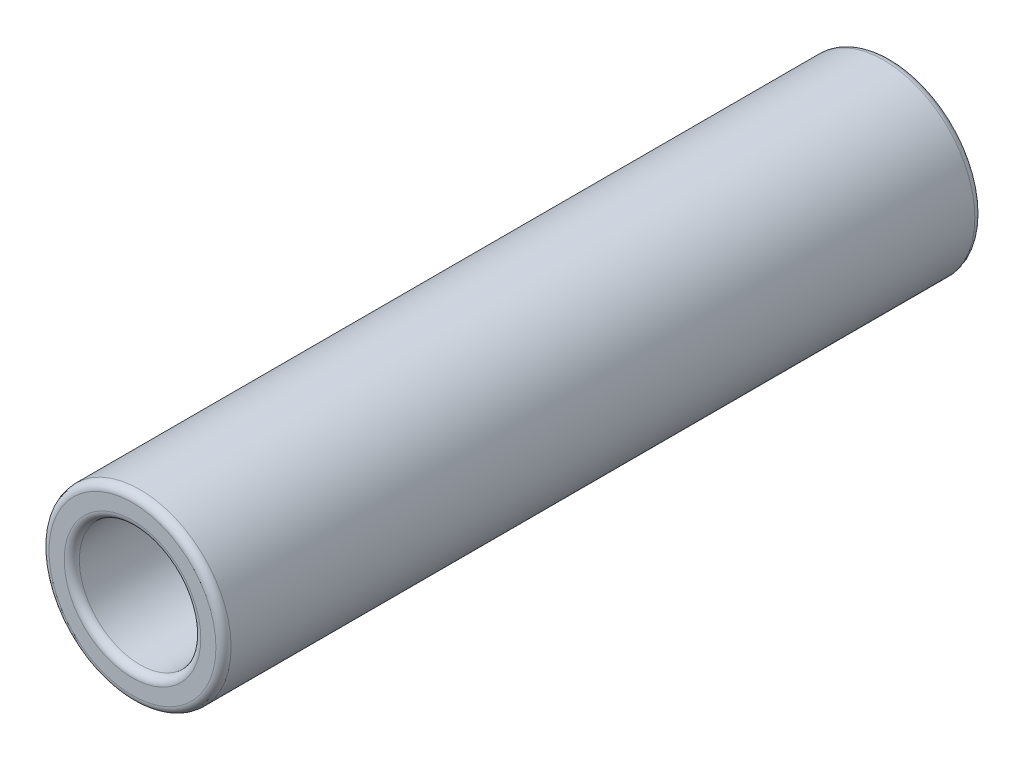
from build123d import *

# Parameters (mm, degrees)
SKETCH1_R           = 6
SKETCH1_R_2         = 4
BOSS_EXTRUDE1_DEPTH = 25
FILLET1_R           = 0.5


with BuildPart() as part:
    # Sketch1 → Boss-Extrude1 (new, symmetric)
    with BuildSketch(Plane.XY):
        Circle(SKETCH1_R)
        Circle(SKETCH1_R_2, mode=Mode.SUBTRACT)
    extrude(amount=BOSS_EXTRUDE1_DEPTH, both=True)

    # Fillet1
    fillet1_edges = [part.edges().sort_by_distance(p)[0] for p in [
        (-6, 0, -25),
        (-6, 0, 25),
        (-4, 0, -25),
        (-4, 0, 25),
    ]]
    fillet(fillet1_edges, radius=FILLET1_R)


solid = part.part
